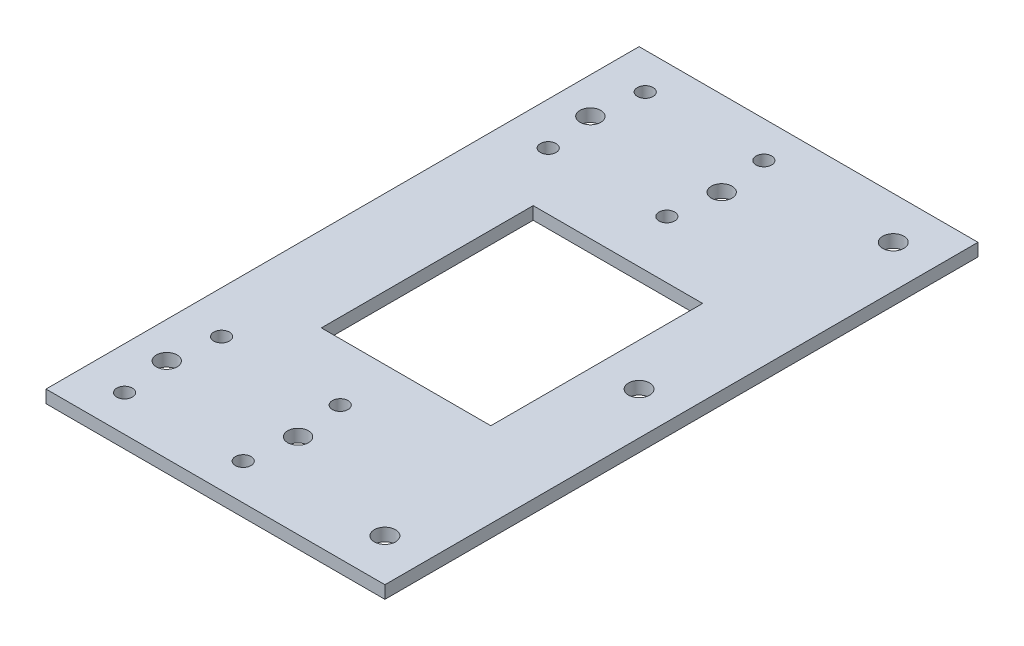
from build123d import *

# Parameters (mm, degrees)
SKETCH_1_R          = 2.5
SKETCH_1_R_2        = 2.45
SKETCH_1_R_3        = 1.85
SKETCH_1_W          = 48
SKETCH_1_H          = 40
EXTRUDE_1_DEPTH     = 3
CUT_EXTRUDE_1_REACH = 82.678
SKETCH_2_W          = 40
SKETCH_2_H          = 50


with BuildPart() as part:
    # 草图1 → 凸台-拉伸1 (new body)
    # profile 1 of 5: a face of its own
    with BuildSketch(Plane(origin=(0, 0, 0), x_dir=(1, 0, 0), z_dir=(0, 1, 0))):
        with BuildLine():
            Line((8, -30), (8, -70))
            Line((8, -70), (40, -70))
            Line((40, -70), (40, 60))
            Line((40, 60), (32.5, 60))
            ThreePointArc((32.5, 60), (28.232233047, 58.232233047), (30, 62.5))
            Line((30, 62.5), (30, 70))
            Line((30, 70), (8, 70))
            Line((8, 70), (8, 30))
            Line((8, 30), (-40, 30))
            Line((-40, 30), (-40, -30))
            Line((-40, -30), (8, -30))
        make_face()
        with Locations(Location((30, -60, 0), (0, 0, 270))):
            Circle(SKETCH_1_R, mode=Mode.SUBTRACT)
        with Locations(Location((30, 0, 0), (0, 0, 270))):
            Circle(SKETCH_1_R, mode=Mode.SUBTRACT)
    # profile 2 of 5: a face of its own
    with BuildSketch(Plane(origin=(0, 0, 0), x_dir=(1, 0, 0), z_dir=(0, 1, 0))):
        with BuildLine():
            Line((32.5, 60), (40, 60))
            Line((40, 60), (40, 70))
            Line((40, 70), (30, 70))
            Line((30, 70), (30, 62.5))
            ThreePointArc((30, 62.5), (31.767766953, 61.767766953), (32.5, 60))
        make_face()
    # profile 3 of 5: a face of its own
    with BuildSketch(Plane(origin=(0, 0, 0), x_dir=(1, 0, 0), z_dir=(0, 1, 0))):
        with BuildLine():
            Line((-40, 61.45), (-40, 30))
            Line((-40, 30), (8, 30))
            Line((8, 30), (8, 70))
            Line((8, 70), (-30, 70))
            Line((-30, 70), (-30, 63.3))
            ThreePointArc((-30, 63.3), (-28.691852455, 62.758147545), (-28.15, 61.45))
            ThreePointArc((-28.15, 61.45), (-30, 59.6), (-31.85, 61.45))
            Line((-31.85, 61.45), (-40, 61.45))
        make_face()
        with Locations(Location((-31.5, 50, 0), (0, 0, 270))):
            Circle(SKETCH_1_R_2, mode=Mode.SUBTRACT)
        with Locations(Location((-30, 38.55, 0), (0, 0, 270))):
            Circle(SKETCH_1_R_3, mode=Mode.SUBTRACT)
        with Locations(Location((-2, 38.55, 0), (0, 0, 270))):
            Circle(SKETCH_1_R_3, mode=Mode.SUBTRACT)
        with Locations(Location((-0.5, 50, 0), (0, 0, 270))):
            Circle(SKETCH_1_R_2, mode=Mode.SUBTRACT)
        with Locations(Location((-2, 61.45, 0), (0, 0, 270))):
            Circle(SKETCH_1_R_3, mode=Mode.SUBTRACT)
    # profile 4 of 5: a face of its own
    with BuildSketch(Plane(origin=(0, 0, 0), x_dir=(1, 0, 0), z_dir=(0, 1, 0))):
        with BuildLine():
            Line((-40, 70), (-40, 61.45))
            Line((-40, 61.45), (-31.85, 61.45))
            ThreePointArc((-31.85, 61.45), (-31.308147545, 62.758147545), (-30, 63.3))
            Line((-30, 63.3), (-30, 70))
            Line((-30, 70), (-40, 70))
        make_face()
    # profile 5 of 5: a face of its own
    with BuildSketch(Plane(origin=(0, 0, 0), x_dir=(1, 0, 0), z_dir=(0, 1, 0))):
        with Locations((-16, -50)):
            Rectangle(SKETCH_1_W, SKETCH_1_H)
        with Locations(Location((-30, -61.45, 0), (0, 0, 270))):
            Circle(SKETCH_1_R_3, mode=Mode.SUBTRACT)
        with Locations(Location((-31.5, -50, 0), (0, 0, 270))):
            Circle(SKETCH_1_R_2, mode=Mode.SUBTRACT)
        with Locations(Location((-30, -38.55, 0), (0, 0, 270))):
            Circle(SKETCH_1_R_3, mode=Mode.SUBTRACT)
        with Locations(Location((-2, -61.45, 0), (0, 0, 270))):
            Circle(SKETCH_1_R_3, mode=Mode.SUBTRACT)
        with Locations(Location((-0.5, -50, 0), (0, 0, 270))):
            Circle(SKETCH_1_R_2, mode=Mode.SUBTRACT)
        with Locations(Location((-2, -38.55, 0), (0, 0, 270))):
            Circle(SKETCH_1_R_3, mode=Mode.SUBTRACT)
    extrude(amount=EXTRUDE_1_DEPTH)

    # 草图2 → 切除-拉伸1 (cut, up to next)
    with BuildSketch(Plane(origin=(0, 3, 0), x_dir=(1, 0, 0), z_dir=(0, 1, 0)), mode=Mode.PRIVATE) as cut_extrude_1_sk1:
        Rectangle(SKETCH_2_W, SKETCH_2_H)
    cut_extrude_1_tool1 = extrude(cut_extrude_1_sk1.sketch, amount=-CUT_EXTRUDE_1_REACH, mode=Mode.PRIVATE) & part.part
    add(cut_extrude_1_tool1.solids().sort_by_distance((0, 3, 0))[0], mode=Mode.SUBTRACT)


solid = part.part
